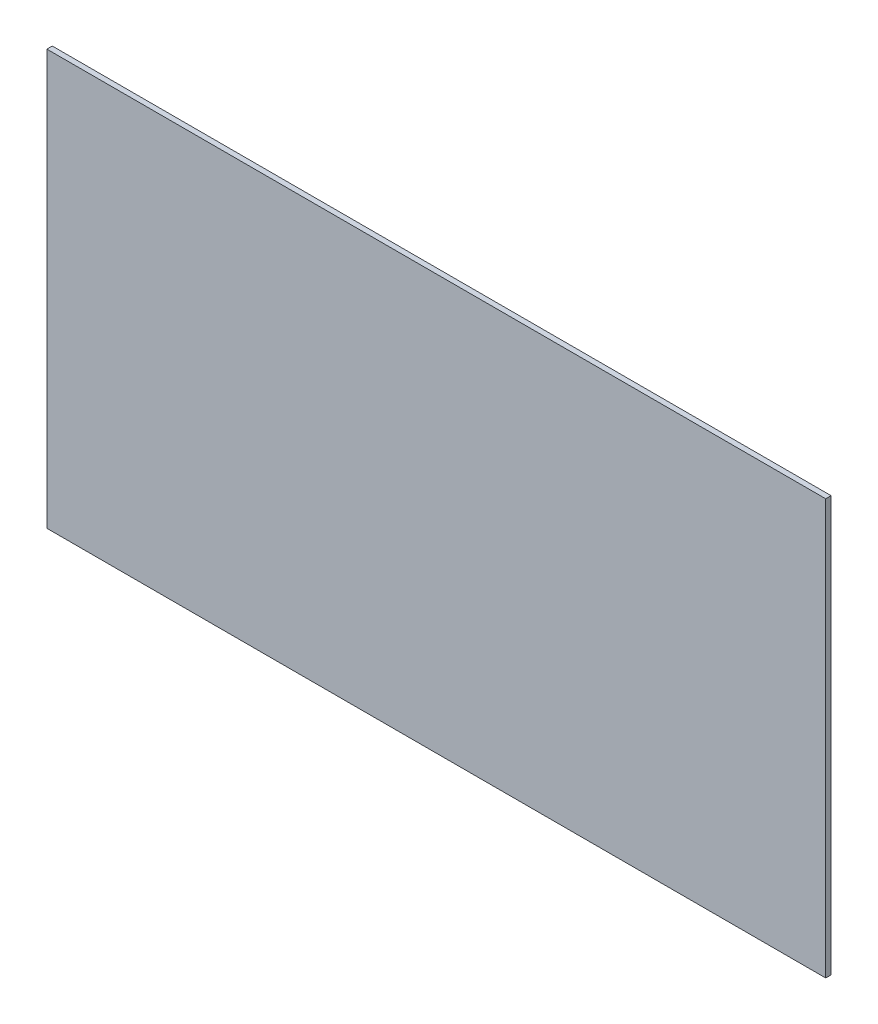
from build123d import *

# Parameters (mm, degrees)
SKETCH1_W           = 1835.15
SKETCH1_H           = 977.9
BOSS_EXTRUDE1_DEPTH = 12.7


with BuildPart() as part:
    # Sketch1 → Boss-Extrude1 (new body)
    with BuildSketch(Plane.XY):
        with Locations((917.575, 488.95)):
            Rectangle(SKETCH1_W, SKETCH1_H)
    extrude(amount=BOSS_EXTRUDE1_DEPTH)


solid = part.part
